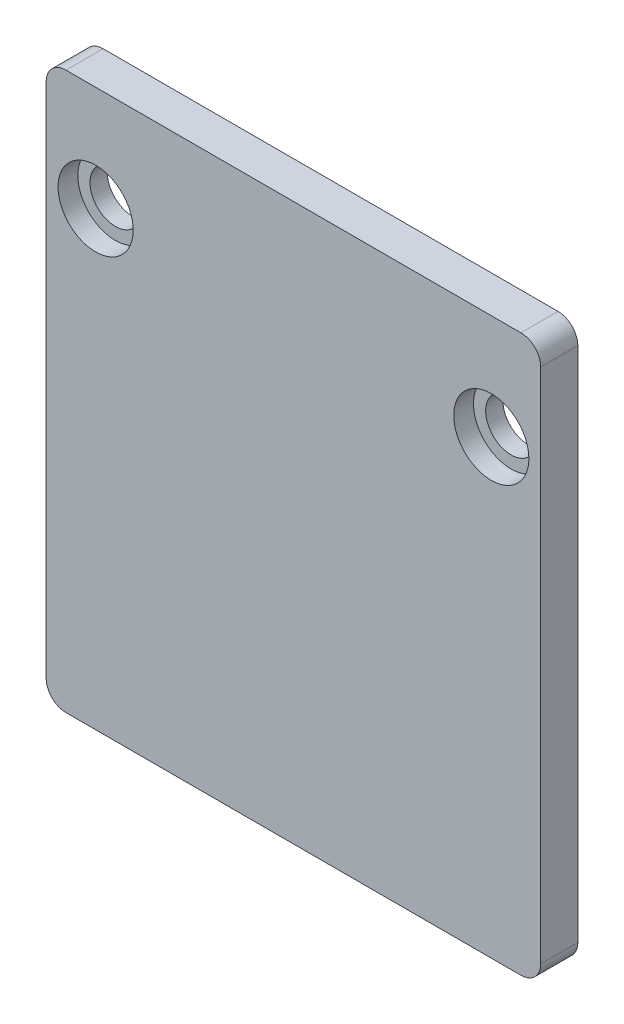
from build123d import *

# Parameters (mm, degrees)
SKETCH1_W                                        = 63.5
SKETCH1_H                                        = 71.4375
BOSS_EXTRUDE1_DEPTH                              = 4.7625
CBORE_FOR_1_4_SOCKET_HEAD_CAP_SCREW1_D           = 6.5278
CBORE_FOR_1_4_SOCKET_HEAD_CAP_SCREW1_CBORE_D     = 9.652
CBORE_FOR_1_4_SOCKET_HEAD_CAP_SCREW1_CBORE_DEPTH = 2.54
FILLET2_R                                        = 2.54


with BuildPart() as part:
    # Sketch1 → Boss-Extrude1 (new body)
    with BuildSketch(Plane.XY):
        with Locations((31.75, 35.71875)):
            Rectangle(SKETCH1_W, SKETCH1_H)
    extrude(amount=BOSS_EXTRUDE1_DEPTH)

    # CBORE for 1/4 Socket Head Cap Screw1 (through all)
    with Locations(Plane.XY.offset(4.7625)):
        with Locations((57.15, 57.9501), (6.35, 57.9501)):
            CounterBoreHole(CBORE_FOR_1_4_SOCKET_HEAD_CAP_SCREW1_D / 2, CBORE_FOR_1_4_SOCKET_HEAD_CAP_SCREW1_CBORE_D / 2, CBORE_FOR_1_4_SOCKET_HEAD_CAP_SCREW1_CBORE_DEPTH)

    # Fillet2
    fillet2_edges = [part.edges().sort_by_distance(p)[0] for p in [
        (0, 71.4375, 2.38125),
        (63.5, 71.4375, 2.38125),
        (63.5, 0, 2.38125),
        (0, 0, 2.38125),
    ]]
    fillet(fillet2_edges, radius=FILLET2_R)


solid = part.part
